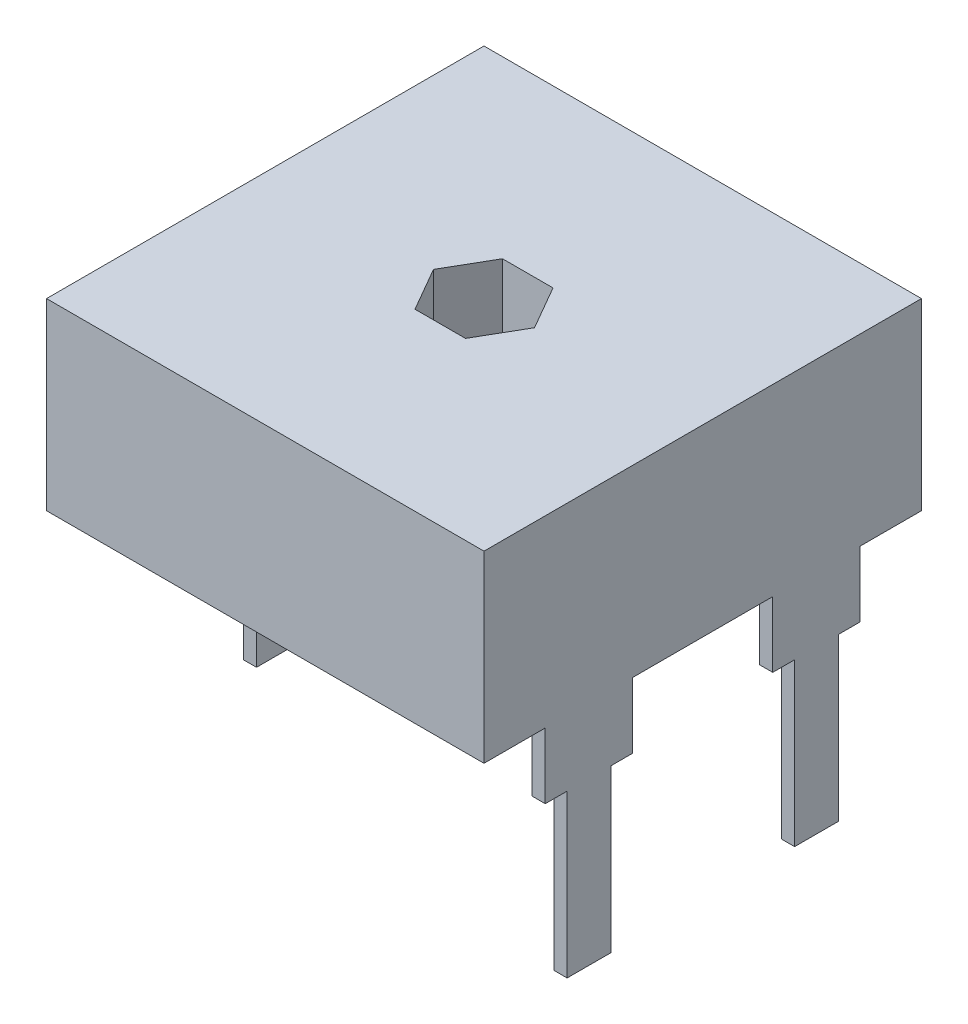
from build123d import *

# Parameters (mm, degrees)
SKETCH1_W           = 10
SKETCH1_H           = 10
BOSS_EXTRUDE1_DEPTH = 4.2
CUT_EXTRUDE1_REACH  = 10.224
SKETCH3_W           = 0.3
SKETCH3_H           = 2
BOSS_EXTRUDE2_DEPTH = 1.5
SKETCH4_W           = 0.3
SKETCH4_H           = 1
BOSS_EXTRUDE3_DEPTH = 3.7


with BuildPart() as part:
    # Sketch1 → Boss-Extrude1 (new body)
    with BuildSketch(Plane(origin=(0, 0, 0), x_dir=(1, 0, 0), z_dir=(0, 1, 0))):
        Rectangle(SKETCH1_W, SKETCH1_H)
    extrude(amount=-BOSS_EXTRUDE1_DEPTH)

    # Sketch2 → Cut-Extrude1 (cut, up to next)
    with BuildSketch(Plane(origin=(0, 0, 0), x_dir=(1, 0, 0), z_dir=(0, 1, 0)), mode=Mode.PRIVATE) as cut_extrude1_sk1:
        Polygon((1.154700538, 0), (0.577350269, 1), (-0.577350269, 1), (-1.154700538, 0), (-0.577350269, -1), (0.577350269, -1), align=None)
    cut_extrude1_tool1 = extrude(cut_extrude1_sk1.sketch, amount=-CUT_EXTRUDE1_REACH, mode=Mode.PRIVATE) & part.part
    add(cut_extrude1_tool1.solids().sort_by_distance((0, 0, 0))[0], mode=Mode.SUBTRACT)

    # Sketch3 → Boss-Extrude2 (add)
    with BuildSketch(Plane.XZ.offset(4.2)):
        with Locations((4.85, 2.6)):
            Rectangle(SKETCH3_W, SKETCH3_H)
        with Locations((4.85, -2.6)):
            Rectangle(SKETCH3_W, SKETCH3_H)
        with Locations((-4.85, 0)):
            Rectangle(SKETCH3_W, SKETCH3_H)
    extrude(amount=BOSS_EXTRUDE2_DEPTH)

    # Sketch4 → Boss-Extrude3 (add)
    with BuildSketch(Plane.XZ.offset(5.7)):
        with Locations((4.85, -2.6)):
            Rectangle(SKETCH4_W, SKETCH4_H)
        with Locations((-4.85, 0)):
            Rectangle(SKETCH4_W, SKETCH4_H)
        with Locations((4.85, 2.6)):
            Rectangle(SKETCH4_W, SKETCH4_H)
    extrude(amount=BOSS_EXTRUDE3_DEPTH)


solid = part.part
